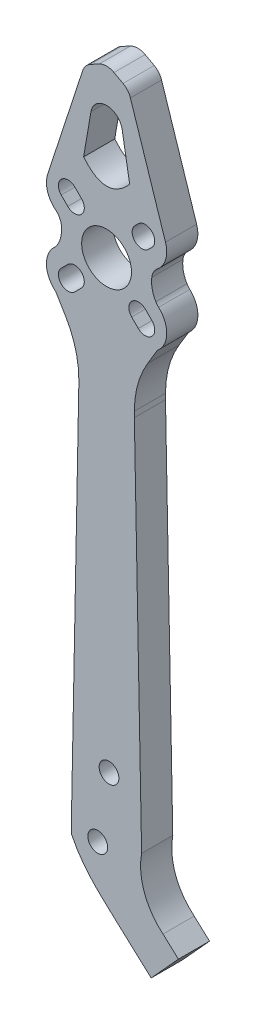
from build123d import *

# Parameters (mm, degrees)
CROQUIS1_R              = 1.59
CROQUIS1_R_2            = 1.5875
CROQUIS1_R_3            = 4
SALIENTE_EXTRUIR1_DEPTH = 5


with BuildPart() as part:
    # Croquis1 → Saliente-Extruir1 (new body)
    with BuildSketch(Plane.XY):
        with BuildLine():
            ThreePointArc((1.193677036, 26.351337281), (0.615813463, 26.577686227), (0, 26.654718258))
            ThreePointArc((0, 26.654718258), (-0.615813463, 26.577686227), (-1.193677036, 26.351337281))
            Line((-1.193677036, 26.351337281), (-2.643396871, 25.563536913))
            ThreePointArc((-2.643396871, 25.563536913), (-3.37085174, 24.966684186), (-3.826144074, 24.143196083))
            Line((-3.826144074, 24.143196083), (-9.459133033, 6.898899359))
            ThreePointArc((-9.459133033, 6.898899359), (-9.492428214, 4.521789334), (-8.170864273, 2.54562401))
            ThreePointArc((-8.170864273, 2.54562401), (-7.560847643, 1.822599507), (-7.263149059, 0.924679537))
            ThreePointArc((-7.263149059, 0.924679537), (-7.323699332, -0.668363985), (-7.905472696, -2.152612532))
            ThreePointArc((-7.905472696, -2.152612532), (-8.1122929, -2.44647205), (-8.359106022, -2.707644973))
            ThreePointArc((-8.359106022, -2.707644973), (-9.655003955, -5.778505112), (-8.174803271, -8.764897481))
            Line((-8.174803271, -8.764897481), (-6.609038667, -11.365635857))
            ThreePointArc((-6.609038667, -11.365635857), (-5.007106824, -15.087530614), (-4.459817284, -19.102398031))
            Line((-4.459817284, -19.102398031), (-4.459817284, -20))
            Line((-4.459817284, -20), (-5.626230736, -80))
            Line((-5.626230736, -80), (-5.626230736, -82.958659211))
            add(Edge.make_bspline(
                [(-5.626230736, -82.958659211), (-3.957996586, -86.469029482), (-1.373693138, -88.776535361), (1.33959564, -91.266262586)],
                knots=[0, 0, 0, 0, 0.775055833, 0.775055833, 0.775055833, 0.775055833], degree=3))
            Line((1.33959564, -91.266262586), (7.160508284, -96.56338139))
            Line((7.160508284, -96.56338139), (11.535313635, -91.755983118))
            Line((11.535313635, -91.755983118), (9.058275941, -89.496367102))
            ThreePointArc((9.058275941, -89.496367102), (6.055620379, -85.213180579), (5.626230736, -80))
            Line((5.626230736, -80), (4.459817284, -20))
            Line((4.459817284, -20), (4.459817284, -19.102398031))
            ThreePointArc((4.459817284, -19.102398031), (5.007106824, -15.087530614), (6.609038667, -11.365635857))
            Line((6.609038667, -11.365635857), (8.174803271, -8.764897481))
            ThreePointArc((8.174803271, -8.764897481), (9.655003955, -5.778505112), (8.359106022, -2.707644973))
            ThreePointArc((8.359106022, -2.707644973), (8.1122929, -2.44647205), (7.905472696, -2.152612532))
            ThreePointArc((7.905472696, -2.152612532), (7.323699332, -0.668363985), (7.263149059, 0.924679537))
            ThreePointArc((7.263149059, 0.924679537), (7.560847643, 1.822599507), (8.170864273, 2.54562401))
            ThreePointArc((8.170864273, 2.54562401), (9.492428214, 4.521789334), (9.459133033, 6.898899359))
            Line((9.459133033, 6.898899359), (3.826144074, 24.143196083))
            ThreePointArc((3.826144074, 24.143196083), (3.37085174, 24.966684186), (2.643396871, 25.563536913))
            Line((2.643396871, 25.563536913), (1.193677036, 26.351337281))
        make_face()
        with Locations((-1.416184287, -81.918657321)):
            Circle(CROQUIS1_R, mode=Mode.SUBTRACT)
        with Locations((0.39268377, -71.387686118)):
            Circle(CROQUIS1_R_2, mode=Mode.SUBTRACT)
        with BuildLine():
            ThreePointArc((-5.091168825, -7.283199846), (-7.283199846, -7.283199846), (-7.283199846, -5.091168825))
            Line((-7.283199846, -5.091168825), (-6.222539674, -4.030508653))
            ThreePointArc((-6.222539674, -4.030508653), (-4.030508653, -4.030508653), (-4.030508653, -6.222539674))
            Line((-4.030508653, -6.222539674), (-5.091168825, -7.283199846))
        make_face(mode=Mode.SUBTRACT)
        with BuildLine():
            ThreePointArc((-7.283199846, 5.091168825), (-7.283199846, 7.283199846), (-5.091168825, 7.283199846))
            Line((-5.091168825, 7.283199846), (-4.030508653, 6.222539674))
            ThreePointArc((-4.030508653, 6.222539674), (-4.030508653, 4.030508653), (-6.222539674, 4.030508653))
            Line((-6.222539674, 4.030508653), (-7.283199846, 5.091168825))
        make_face(mode=Mode.SUBTRACT)
        Circle(CROQUIS1_R_3, mode=Mode.SUBTRACT)
        with BuildLine():
            Line((-3.690213899, 12.181248638), (-2.502144822, 19.079689902))
            ThreePointArc((-2.502144822, 19.079689902), (-1.635896096, 20.590481825), (0, 21.187744795))
            ThreePointArc((0, 21.187744795), (1.635896096, 20.590481825), (2.502144822, 19.079689902))
            Line((2.502144822, 19.079689902), (3.707704632, 12.079689902))
            add(Edge.make_bspline(
                [(3.707704632, 12.079689902), (-0.039943984, 7.807746472), (-3.690213899, 12.181248638)],
                knots=[0.502108549, 0.502108549, 0.502108549, 1.502108549, 1.502108549, 1.502108549], degree=2))
        make_face(mode=Mode.SUBTRACT)
        with BuildLine():
            ThreePointArc((7.283199846, -5.091168825), (7.283199846, -7.283199846), (5.091168825, -7.283199846))
            Line((5.091168825, -7.283199846), (4.030508653, -6.222539674))
            ThreePointArc((4.030508653, -6.222539674), (4.030508653, -4.030508653), (6.222539674, -4.030508653))
            Line((6.222539674, -4.030508653), (7.283199846, -5.091168825))
        make_face(mode=Mode.SUBTRACT)
        with BuildLine():
            Line((4.560838717, 6.752869739), (5.091168825, 7.283199846))
            ThreePointArc((5.091168825, 7.283199846), (7.283199846, 7.283199846), (7.283199846, 5.091168825))
            Line((7.283199846, 5.091168825), (6.752869872, 4.56083885))
            ThreePointArc((6.752869872, 4.56083885), (4.560838805, 4.560838672), (4.560838717, 6.752869739))
        make_face(mode=Mode.SUBTRACT)
    extrude(amount=SALIENTE_EXTRUIR1_DEPTH)


solid = part.part
